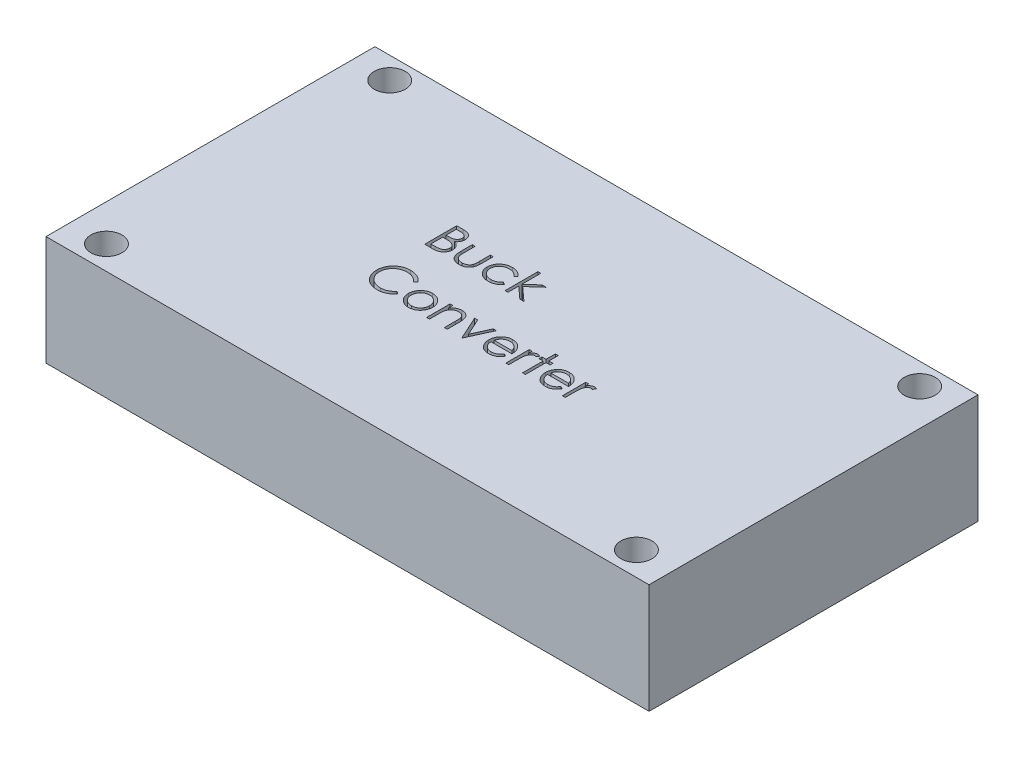
from build123d import *

# Parameters (mm, degrees)
SKETCH1_W           = 66
SKETCH1_H           = 36
BOSS_EXTRUDE1_DEPTH = 12
SKETCH2_R           = 1.7
CUT_EXTRUDE1_DEPTH  = 40.458839314


with BuildPart() as part:
    # Sketch1 → Boss-Extrude1 (new body)
    with BuildSketch(Plane(origin=(0, 0, 0), x_dir=(1, 0, 0), z_dir=(0, 1, 0))):
        Rectangle(SKETCH1_W, SKETCH1_H)
    extrude(amount=BOSS_EXTRUDE1_DEPTH)

    # Sketch2 → Cut-Extrude1 (cut, through all)
    # profile 1 of 17: a face of its own
    with BuildSketch(Plane(origin=(0, 12, 0), x_dir=(1, 0, 0), z_dir=(0, 1, 0))):
        with Locations(Location((-29, 15.616090754, 0), (0, 0, 270))):
            Circle(SKETCH2_R)
    # profile 2 of 17: a face of its own
    with BuildSketch(Plane(origin=(0, 12, 0), x_dir=(1, 0, 0), z_dir=(0, 1, 0))):
        with Locations(Location((29, 15.616090754, 0), (0, 0, 270))):
            Circle(SKETCH2_R)
    # profile 3 of 17: a face of its own
    with BuildSketch(Plane(origin=(0, 12, 0), x_dir=(1, 0, 0), z_dir=(0, 1, 0))):
        with Locations(Location((29, -15.383909246, 0), (0, 0, 270))):
            Circle(SKETCH2_R)
    # profile 4 of 17: a face of its own
    with BuildSketch(Plane(origin=(0, 12, 0), x_dir=(1, 0, 0), z_dir=(0, 1, 0))):
        with Locations(Location((-29, -15.383909246, 0), (0, 0, 270))):
            Circle(SKETCH2_R)
    # profile 5 of 17: a face of its own
    with BuildSketch(Plane(origin=(0, 12, 0), x_dir=(1, 0, 0), z_dir=(0, 1, 0))):
        with BuildLine():
            Line((-11.551282051, 5.5), (-10.868389423, 5.5))
            add(Edge.make_bspline(
                [(-10.868389423, 5.5), (-10.834960945, 5.49982425), (-10.770168235, 5.499483602), (-10.675948793, 5.49420047), (-10.587699982, 5.486996801), (-10.50539621, 5.475566708), (-10.429075507, 5.461774931), (-10.35850787, 5.445073115), (-10.293917698, 5.425046501), (-10.216804961, 5.39320022), (-10.128884301, 5.345877051), (-10.033685908, 5.275948486), (-9.952281668, 5.190416023), (-9.882095351, 5.093933368), (-9.826294232, 4.987797596), (-9.785924934, 4.874538407), (-9.760367059, 4.755616665), (-9.757738625, 4.673973487), (-9.756410256, 4.63271234)],
                knots=[0, 0, 0, 0, 1.001505555, 1.941167018, 2.826882275, 3.653841531, 4.429895133, 5.150066043, 5.825578002, 6.45369114, 7.647487171, 8.808567382, 9.977351308, 11.170798116, 12.373658725, 13.556498008, 14.765093433, 16, 16, 16, 16], degree=3))
            add(Edge.make_bspline(
                [(-9.756410256, 4.63271234), (-9.757503475, 4.594059784), (-9.759651752, 4.518103867), (-9.780194512, 4.407009758), (-9.81235518, 4.301258539), (-9.857060429, 4.201236154), (-9.915162425, 4.10920254), (-9.984020744, 4.024415274), (-10.067097546, 3.950464217), (-10.129340786, 3.909121315), (-10.160957532, 3.888120994)],
                knots=[0, 0, 0, 0, 1.044552857, 2.05264487, 3.044412934, 4.028983338, 5.005914585, 5.980388656, 6.974128949, 8, 8, 8, 8], degree=3))
            add(Edge.make_bspline(
                [(-10.160957532, 3.888120994), (-10.121197104, 3.872855995), (-10.045125557, 3.84365027), (-9.940439545, 3.792014806), (-9.8502447, 3.735852696), (-9.773847554, 3.674520846), (-9.708509899, 3.608412035), (-9.651456957, 3.536556921), (-9.602775583, 3.458018163), (-9.561062659, 3.373614627), (-9.528513903, 3.284208159), (-9.504137999, 3.190637383), (-9.49017055, 3.093237828), (-9.488182909, 3.026952448), (-9.487179487, 2.993489583)],
                knots=[0, 0, 0, 0, 1.27268992, 2.434971085, 3.483601985, 4.442670788, 5.356604649, 6.2567628, 7.179492994, 8.113709626, 9.066344395, 10.018646069, 10.999752585, 12, 12, 12, 12], degree=3))
            add(Edge.make_bspline(
                [(-9.487179487, 2.993489583), (-9.488156333, 2.959322711), (-9.490078305, 2.892098433), (-9.504258277, 2.793343299), (-9.528267384, 2.698968352), (-9.56133853, 2.608363169), (-9.604500845, 2.521703035), (-9.657028809, 2.438889771), (-9.719660373, 2.36075544), (-9.789723242, 2.286431817), (-9.868985387, 2.21960403), (-9.954501142, 2.160088323), (-10.047347462, 2.111142261), (-10.145999456, 2.070026239), (-10.251563772, 2.038619041), (-10.36356638, 2.016646467), (-10.481910681, 2.00184143), (-10.563120433, 2.000624225), (-10.604767628, 2)],
                knots=[0, 0, 0, 0, 0.978564426, 1.925352924, 2.850884081, 3.763762016, 4.682927383, 5.618979971, 6.567305752, 7.547517671, 8.540179244, 9.531824382, 10.526200242, 11.540722885, 12.589160233, 13.674978461, 14.80764778, 16, 16, 16, 16], degree=3))
            Line((-10.604767628, 2), (-11.551282051, 2))
            Line((-11.551282051, 2), (-11.551282051, 5.5))
        make_face()
        with BuildLine():
            Line((-11.237179487, 5.141025641), (-11.237179487, 4.019230769))
            Line((-11.237179487, 4.019230769), (-11.026141827, 4.019230769))
            add(Edge.make_bspline(
                [(-11.026141827, 4.019230769), (-10.995293032, 4.019630692), (-10.935686872, 4.020403425), (-10.849366976, 4.022616942), (-10.769241958, 4.028814985), (-10.695450124, 4.035011248), (-10.628107681, 4.045085835), (-10.567363819, 4.057077958), (-10.512265222, 4.069760863), (-10.448725677, 4.09133035), (-10.376652728, 4.123208025), (-10.299819624, 4.172679861), (-10.232085154, 4.231604215), (-10.174887967, 4.299595176), (-10.128076496, 4.374461362), (-10.095562781, 4.455008243), (-10.073515497, 4.539228375), (-10.071523965, 4.597046627), (-10.070512821, 4.626402244)],
                knots=[0, 0, 0, 0, 1.156816544, 2.235205308, 3.236616184, 4.169592532, 5.011045266, 5.787822928, 6.49130361, 7.128639758, 8.301311294, 9.436451833, 10.541879658, 11.654887649, 12.756523258, 13.837046038, 14.901820046, 16, 16, 16, 16], degree=3))
            add(Edge.make_bspline(
                [(-10.070512821, 4.626402244), (-10.071039001, 4.645828015), (-10.072071161, 4.683933787), (-10.080524463, 4.739483141), (-10.094892038, 4.791726894), (-10.113346331, 4.841381004), (-10.13913502, 4.886892854), (-10.169498483, 4.92983605), (-10.206184173, 4.968748169), (-10.247941486, 5.005117667), (-10.295950109, 5.037362195), (-10.350181401, 5.065602958), (-10.411369078, 5.088343735), (-10.478481933, 5.108259887), (-10.55255302, 5.122248181), (-10.632727573, 5.133901569), (-10.719662292, 5.139834311), (-10.779807395, 5.140619673), (-10.810897436, 5.141025641)],
                knots=[0, 0, 0, 0, 0.91205012, 1.789085906, 2.630437955, 3.453916878, 4.269457761, 5.079663411, 5.91843418, 6.774407191, 7.675494373, 8.627863946, 9.638891023, 10.736472738, 11.911756761, 13.175263542, 14.539845004, 16, 16, 16, 16], degree=3))
            Line((-10.810897436, 5.141025641), (-11.237179487, 5.141025641))
        make_face(mode=Mode.SUBTRACT)
        with BuildLine():
            Line((-11.237179487, 3.66025641), (-11.237179487, 2.358974359))
            Line((-11.237179487, 2.358974359), (-10.789863782, 2.358974359))
            add(Edge.make_bspline(
                [(-10.789863782, 2.358974359), (-10.757844856, 2.359358106), (-10.696132598, 2.360097729), (-10.607031367, 2.362512283), (-10.524448264, 2.368004559), (-10.448760128, 2.376650409), (-10.379149675, 2.386028858), (-10.316451972, 2.398640139), (-10.260158779, 2.413089099), (-10.194884471, 2.435423272), (-10.121380963, 2.470119743), (-10.042170106, 2.522433969), (-9.971743888, 2.584757277), (-9.911938629, 2.656888191), (-9.86292564, 2.735319518), (-9.827270185, 2.818464868), (-9.805279329, 2.904950395), (-9.802617159, 2.963917108), (-9.801282051, 2.993489583)],
                knots=[0, 0, 0, 0, 1.160039823, 2.235823828, 3.228722157, 4.157150951, 4.99529583, 5.772374946, 6.472645482, 7.099169577, 8.269452708, 9.405989375, 10.527446681, 11.663510218, 12.788923519, 13.866172445, 14.929861265, 16, 16, 16, 16], degree=3))
            add(Edge.make_bspline(
                [(-9.801282051, 2.993489583), (-9.801558156, 3.011982924), (-9.802105911, 3.048671306), (-9.810366526, 3.102587125), (-9.822380395, 3.154812998), (-9.837911829, 3.205490739), (-9.860531296, 3.253704115), (-9.886937841, 3.300406674), (-9.917899243, 3.345660154), (-9.966143409, 3.402872407), (-10.036315393, 3.46878942), (-10.136022169, 3.533326923), (-10.249394467, 3.58537473), (-10.33162196, 3.607474206), (-10.374098558, 3.618890224)],
                knots=[0, 0, 0, 0, 0.723448775, 1.435228256, 2.130040452, 2.821711965, 3.505591119, 4.210454504, 4.921174351, 5.648778258, 7.137944449, 8.670945889, 10.280296675, 12, 12, 12, 12], degree=3))
            add(Edge.make_bspline(
                [(-10.374098558, 3.618890224), (-10.391127654, 3.622345308), (-10.428050246, 3.629836643), (-10.488257826, 3.637744346), (-10.556993695, 3.644789406), (-10.634416572, 3.650000564), (-10.720624414, 3.655387107), (-10.815801332, 3.657481929), (-10.919558647, 3.659981189), (-10.991551019, 3.660162323), (-11.028946314, 3.66025641)],
                knots=[0, 0, 0, 0, 0.634451884, 1.375622551, 2.216452059, 3.157844607, 4.20941857, 5.370758133, 6.634282058, 8, 8, 8, 8], degree=3))
            Line((-11.028946314, 3.66025641), (-11.237179487, 3.66025641))
        make_face(mode=Mode.SUBTRACT)
    # profile 6 of 17: a face of its own
    with BuildSketch(Plane(origin=(0, 12, 0), x_dir=(1, 0, 0), z_dir=(0, 1, 0))):
        with BuildLine():
            Line((-8.903846154, 4.557692308), (-8.58974359, 4.557692308))
            Line((-8.58974359, 4.557692308), (-8.58974359, 3.371394231))
            add(Edge.make_bspline(
                [(-8.58974359, 3.371394231), (-8.589601685, 3.336571482), (-8.589330227, 3.269957194), (-8.587489286, 3.174102007), (-8.583159193, 3.086685294), (-8.577745368, 3.007656557), (-8.570783232, 2.937029166), (-8.562499872, 2.875049809), (-8.55324145, 2.821015625), (-8.544178736, 2.788472269), (-8.539963942, 2.77333734)],
                knots=[0, 0, 0, 0, 1.388932606, 2.656963016, 3.823490214, 4.879454478, 5.816252168, 6.653371382, 7.373723809, 8, 8, 8, 8], degree=3))
            add(Edge.make_bspline(
                [(-8.539963942, 2.77333734), (-8.533202487, 2.754314469), (-8.519820146, 2.716664208), (-8.495546663, 2.662275202), (-8.465518326, 2.61189992), (-8.432658498, 2.563595847), (-8.39475909, 2.51879386), (-8.352299619, 2.477569617), (-8.306701382, 2.438365526), (-8.238946359, 2.391980734), (-8.146287093, 2.342265403), (-8.024634338, 2.299369585), (-7.892730112, 2.273733765), (-7.801565392, 2.27075951), (-7.754707532, 2.269230769)],
                knots=[0, 0, 0, 0, 0.725840625, 1.436591201, 2.137033971, 2.831655856, 3.53531722, 4.242432219, 4.957935707, 5.694543706, 7.190802206, 8.724350549, 10.316345118, 12, 12, 12, 12], degree=3))
            add(Edge.make_bspline(
                [(-7.754707532, 2.269230769), (-7.707854024, 2.270792018), (-7.617201156, 2.273812745), (-7.486746187, 2.298596284), (-7.367494772, 2.340001973), (-7.260643821, 2.397809384), (-7.166677981, 2.468551447), (-7.088373562, 2.551560256), (-7.023766308, 2.644209643), (-6.995556887, 2.713333922), (-6.981370192, 2.748096955)],
                knots=[0, 0, 0, 0, 1.157059328, 2.238695713, 3.266970494, 4.264342957, 5.228770407, 6.160125903, 7.074715775, 8, 8, 8, 8], degree=3))
            add(Edge.make_bspline(
                [(-6.981370192, 2.748096955), (-6.977175962, 2.762063254), (-6.967903544, 2.792939329), (-6.957941192, 2.845319078), (-6.948966731, 2.907783682), (-6.941303555, 2.980741891), (-6.935838392, 3.064003043), (-6.932892365, 3.157541119), (-6.92956409, 3.26106248), (-6.929513574, 3.333530239), (-6.929487179, 3.371394231)],
                knots=[0, 0, 0, 0, 0.557542046, 1.232589297, 2.036731608, 2.971723315, 4.038036528, 5.22795436, 6.551621927, 8, 8, 8, 8], degree=3))
            Line((-6.929487179, 3.371394231), (-6.929487179, 4.557692308))
            Line((-6.929487179, 4.557692308), (-6.615384615, 4.557692308))
            Line((-6.615384615, 4.557692308), (-6.615384615, 3.3125))
            add(Edge.make_bspline(
                [(-6.615384615, 3.3125), (-6.61582631, 3.270192829), (-6.616683259, 3.188111129), (-6.622190602, 3.068827017), (-6.631640215, 2.957664772), (-6.6459829, 2.854565552), (-6.662848574, 2.759608071), (-6.684604847, 2.672670625), (-6.710583085, 2.594021071), (-6.7398886, 2.522279294), (-6.774510468, 2.4572324), (-6.811337488, 2.395496583), (-6.85386226, 2.338603648), (-6.898632494, 2.283721511), (-6.94843415, 2.233579983), (-7.002334009, 2.187028507), (-7.059573429, 2.143355476), (-7.121422627, 2.104264196), (-7.18697869, 2.069047551), (-7.256322547, 2.037831473), (-7.330303545, 2.013128896), (-7.407967182, 1.99181823), (-7.489693961, 1.975103761), (-7.575405094, 1.963317194), (-7.665071711, 1.956091863), (-7.72618117, 1.955454818), (-7.757512019, 1.955128205)],
                knots=[0, 0, 0, 0, 1.493040784, 2.896703357, 4.213163133, 5.428574705, 6.569057535, 7.615249723, 8.588095153, 9.490268104, 10.346124644, 11.18633936, 12.024365274, 12.850166724, 13.684164916, 14.514361689, 15.362232829, 16.222528818, 17.093394965, 17.986930858, 18.902426812, 19.842810585, 20.827885679, 21.843828298, 22.894529745, 24, 24, 24, 24], degree=3))
            add(Edge.make_bspline(
                [(-7.757512019, 1.955128205), (-7.788608533, 1.955467912), (-7.849716078, 1.956135468), (-7.939387323, 1.963277276), (-8.025335929, 1.975085447), (-8.107256327, 1.991940664), (-8.185230725, 2.012979734), (-8.259574965, 2.03798327), (-8.329418528, 2.069063751), (-8.395600532, 2.104041309), (-8.45760292, 2.143606584), (-8.515711498, 2.186974624), (-8.56984835, 2.234080687), (-8.620025419, 2.284728044), (-8.665538395, 2.33954498), (-8.706954437, 2.398090541), (-8.744911142, 2.459784629), (-8.779263932, 2.525847792), (-8.808775688, 2.598419802), (-8.834830934, 2.678716899), (-8.856141572, 2.767619415), (-8.87348404, 2.865051344), (-8.887435481, 2.970546385), (-8.897121623, 3.084714801), (-8.902537454, 3.207278493), (-8.903400515, 3.291928383), (-8.903846154, 3.335637019)],
                knots=[0, 0, 0, 0, 1.083640291, 2.129454052, 3.13281866, 4.105697902, 5.042300162, 5.946461698, 6.836384745, 7.703652036, 8.553297018, 9.397182691, 10.228592656, 11.052265423, 11.879314572, 12.708807002, 13.549817954, 14.402308542, 15.300838682, 16.27712199, 17.341985831, 18.484375296, 19.725102775, 21.0496083, 22.476576903, 24, 24, 24, 24], degree=3))
            Line((-8.903846154, 3.335637019), (-8.903846154, 4.557692308))
        make_face()
    # profile 7 of 17: a face of its own
    with BuildSketch(Plane(origin=(0, 12, 0), x_dir=(1, 0, 0), z_dir=(0, 1, 0))):
        with BuildLine():
            Line((-3.384615385, 4.003104968), (-3.647536058, 3.83974359))
            add(Edge.make_bspline(
                [(-3.647536058, 3.83974359), (-3.676365923, 3.875571984), (-3.733112618, 3.946094094), (-3.831651855, 4.037104027), (-3.936663269, 4.115271069), (-4.049941317, 4.17897482), (-4.171327117, 4.22819627), (-4.300341968, 4.263026476), (-4.436967473, 4.284730719), (-4.530632672, 4.287197555), (-4.578625801, 4.288461538)],
                knots=[0, 0, 0, 0, 1.026593902, 2.0206758, 2.988051866, 3.946915611, 4.916868779, 5.907761954, 6.927957743, 8, 8, 8, 8], degree=3))
            add(Edge.make_bspline(
                [(-4.578625801, 4.288461538), (-4.616984758, 4.287404696), (-4.692531681, 4.285323274), (-4.803437834, 4.272312781), (-4.909080187, 4.248670773), (-5.010120896, 4.217519816), (-5.105841315, 4.175769526), (-5.196492233, 4.12495977), (-5.282877723, 4.06590973), (-5.362494465, 3.997499184), (-5.435323472, 3.923100516), (-5.498422386, 3.843346821), (-5.553359319, 3.76062693), (-5.596465275, 3.672875188), (-5.631740446, 3.582099134), (-5.654947166, 3.486585279), (-5.670411861, 3.387557271), (-5.67218119, 3.320038931), (-5.673076923, 3.285857372)],
                knots=[0, 0, 0, 0, 1.112346261, 2.190735716, 3.231507886, 4.247384806, 5.251966152, 6.253067467, 7.256802811, 8.280671706, 9.291813951, 10.270744147, 11.225547591, 12.165006084, 13.100104208, 14.043489273, 15.009504848, 16, 16, 16, 16], degree=3))
            add(Edge.make_bspline(
                [(-5.673076923, 3.285857372), (-5.671297671, 3.241088161), (-5.66776314, 3.152152965), (-5.640061681, 3.020874863), (-5.594717273, 2.893951173), (-5.532659423, 2.772283036), (-5.454182288, 2.65968888), (-5.362009725, 2.558705426), (-5.256090642, 2.471289398), (-5.137358311, 2.398816873), (-5.008600567, 2.340555505), (-4.871210463, 2.299048172), (-4.726310682, 2.2739958), (-4.627103935, 2.270839857), (-4.576522436, 2.269230769)],
                knots=[0, 0, 0, 0, 0.966302908, 1.919585723, 2.883856336, 3.870342332, 4.860282998, 5.839159637, 6.814385684, 7.815993281, 8.834850808, 9.858348828, 10.908058873, 12, 12, 12, 12], degree=3))
            add(Edge.make_bspline(
                [(-4.576522436, 2.269230769), (-4.530167252, 2.270530266), (-4.439067013, 2.273084123), (-4.305899728, 2.294613087), (-4.179119817, 2.32985672), (-4.058731787, 2.37900437), (-3.944955621, 2.442531886), (-3.838526446, 2.520891057), (-3.737326507, 2.611827657), (-3.677829531, 2.682145629), (-3.647536058, 2.717948718)],
                knots=[0, 0, 0, 0, 1.039848629, 2.043578496, 3.018386758, 3.987534228, 4.954977003, 5.934852016, 6.948509513, 8, 8, 8, 8], degree=3))
            Line((-3.647536058, 2.717948718), (-3.384615385, 2.545472756))
            add(Edge.make_bspline(
                [(-3.384615385, 2.545472756), (-3.400203087, 2.522582029), (-3.431326754, 2.476876553), (-3.483354379, 2.412432436), (-3.539474211, 2.352110754), (-3.599467308, 2.295992364), (-3.662550318, 2.242734345), (-3.730878227, 2.19488277), (-3.802247839, 2.149747947), (-3.877496996, 2.109135075), (-3.955847694, 2.072628754), (-4.037189684, 2.041237583), (-4.121169497, 2.014267477), (-4.207885873, 1.99283013), (-4.297509771, 1.975719292), (-4.389809406, 1.96436559), (-4.484752987, 1.955890309), (-4.548925139, 1.955384442), (-4.581430288, 1.955128205)],
                knots=[0, 0, 0, 0, 0.954134338, 1.905101784, 2.851144739, 3.791306361, 4.734911809, 5.6936923, 6.663572882, 7.643865596, 8.638447847, 9.640600242, 10.646758161, 11.676244097, 12.717260333, 13.78922464, 14.880174919, 16, 16, 16, 16], degree=3))
            add(Edge.make_bspline(
                [(-4.581430288, 1.955128205), (-4.631041172, 1.956019485), (-4.728278864, 1.9577664), (-4.870601372, 1.976974875), (-5.006615039, 2.005932491), (-5.136273397, 2.047496225), (-5.259596631, 2.101001001), (-5.37646975, 2.166357915), (-5.486505768, 2.244109705), (-5.58861655, 2.332872475), (-5.682397997, 2.429113115), (-5.762924187, 2.532963033), (-5.832769458, 2.640604081), (-5.888857001, 2.754413607), (-5.933503927, 2.87287898), (-5.96400876, 2.99694922), (-5.983738497, 3.125601474), (-5.986021877, 3.213334356), (-5.987179487, 3.2578125)],
                knots=[0, 0, 0, 0, 1.1129367, 2.181364009, 3.217532258, 4.231199276, 5.232079859, 6.230262199, 7.231623845, 8.250719726, 9.263571943, 10.242672461, 11.195837495, 12.138959767, 13.085126421, 14.0317438, 15.002148558, 16, 16, 16, 16], degree=3))
            add(Edge.make_bspline(
                [(-5.987179487, 3.2578125), (-5.986738471, 3.287990935), (-5.985861217, 3.348020822), (-5.975799289, 3.437115889), (-5.962800816, 3.525024434), (-5.940775079, 3.610632153), (-5.915334448, 3.695237443), (-5.882858916, 3.777820545), (-5.844763521, 3.858765217), (-5.801511574, 3.937862947), (-5.752822829, 4.013812487), (-5.698941595, 4.085566151), (-5.641897259, 4.153985917), (-5.579021147, 4.216709677), (-5.512981493, 4.276245869), (-5.441909918, 4.331003993), (-5.366214066, 4.381144984), (-5.287030743, 4.427595999), (-5.204406032, 4.468955434), (-5.118839362, 4.504588672), (-5.030846332, 4.535041248), (-4.940286188, 4.559150167), (-4.847760015, 4.579367591), (-4.752538677, 4.592085437), (-4.654986455, 4.60107171), (-4.588930432, 4.602062502), (-4.555488782, 4.602564103)],
                knots=[0, 0, 0, 0, 0.990994727, 1.971252077, 2.943264845, 3.907940874, 4.872158414, 5.844625996, 6.82015047, 7.809835459, 8.804511986, 9.781214284, 10.756496977, 11.728388426, 12.696359165, 13.676225489, 14.672885716, 15.677705647, 16.690706858, 17.706033469, 18.721040654, 19.747369689, 20.783475414, 21.830280724, 22.901553713, 24, 24, 24, 24], degree=3))
            add(Edge.make_bspline(
                [(-4.555488782, 4.602564103), (-4.513608674, 4.601642212), (-4.430057794, 4.599803037), (-4.306117088, 4.584324385), (-4.184001894, 4.560987969), (-4.06585479, 4.526415139), (-3.953108276, 4.484551483), (-3.847572826, 4.437538769), (-3.751732722, 4.382944165), (-3.663805133, 4.323224051), (-3.583625615, 4.255863145), (-3.510371123, 4.180056188), (-3.442539474, 4.096197709), (-3.404082762, 4.034391978), (-3.384615385, 4.003104968)],
                knots=[0, 0, 0, 0, 1.095225653, 2.184976855, 3.262915854, 4.344593502, 5.400796181, 6.407717688, 7.363229445, 8.282371371, 9.184954523, 10.097238608, 11.036792983, 12, 12, 12, 12], degree=3))
        make_face()
    # profile 8 of 17: a face of its own
    with BuildSketch(Plane(origin=(0, 12, 0), x_dir=(1, 0, 0), z_dir=(0, 1, 0))):
        Polygon((-2.756410256, 5.58974359), (-2.442307692, 5.58974359), (-2.442307692, 3.514423077), (-1.278445513, 4.557692308), (-0.826923077, 4.557692308), (-2.177283654, 3.346153846), (-0.692307692, 2), (-1.143129006, 2), (-2.442307692, 3.178585737), (-2.442307692, 2), (-2.756410256, 2), align=None)
    # profile 9 of 17: a face of its own
    with BuildSketch(Plane(origin=(0, 12, 0), x_dir=(1, 0, 0), z_dir=(0, 1, 0))):
        with BuildLine():
            Line((-8.320512821, -1.975560897), (-8.595352564, -2.185897436))
            add(Edge.make_bspline(
                [(-8.595352564, -2.185897436), (-8.614958452, -2.162531466), (-8.653905899, -2.11611455), (-8.716565102, -2.050935006), (-8.781866745, -1.989869744), (-8.849785866, -1.932627865), (-8.921544985, -1.881211099), (-8.995405784, -1.832939996), (-9.072603829, -1.789672258), (-9.179355564, -1.737209272), (-9.319003412, -1.682463117), (-9.494798251, -1.636559886), (-9.67830935, -1.60733871), (-9.803506949, -1.604173869), (-9.8671875, -1.602564103)],
                knots=[0, 0, 0, 0, 0.757959112, 1.505699292, 2.245454638, 2.979532153, 3.711538275, 4.438200793, 5.171680507, 5.909471876, 7.393775596, 8.890124382, 10.418191784, 12, 12, 12, 12], degree=3))
            add(Edge.make_bspline(
                [(-9.8671875, -1.602564103), (-9.902270799, -1.602968065), (-9.972111792, -1.603772241), (-10.075760265, -1.614381366), (-10.177473317, -1.629292576), (-10.277184783, -1.651417899), (-10.374767741, -1.679390518), (-10.470860143, -1.712815932), (-10.564070743, -1.754170772), (-10.655688981, -1.799879032), (-10.743468192, -1.851506477), (-10.82652324, -1.907819829), (-10.904551208, -1.968188925), (-10.97761382, -2.032840032), (-11.045785769, -2.101481992), (-11.108573079, -2.174846334), (-11.16575849, -2.252698507), (-11.218475515, -2.334011915), (-11.265688248, -2.418549706), (-11.305218127, -2.506624777), (-11.34022325, -2.59672888), (-11.367922492, -2.689880041), (-11.389847009, -2.785422807), (-11.404974672, -2.883613595), (-11.415463144, -2.984247274), (-11.41626332, -3.052456587), (-11.416666667, -3.086838942)],
                knots=[0, 0, 0, 0, 1.054917814, 2.100044995, 3.131103042, 4.146048494, 5.169673617, 6.183595914, 7.203665975, 8.234915748, 9.262203917, 10.264457458, 11.251630812, 12.227803204, 13.197192746, 14.159520551, 15.12972552, 16.100847026, 17.073214652, 18.039054194, 19.002613845, 19.979014051, 20.95965708, 21.949030935, 22.966165397, 24, 24, 24, 24], degree=3))
            add(Edge.make_bspline(
                [(-11.416666667, -3.086838942), (-11.415404848, -3.138570262), (-11.412927433, -3.240137847), (-11.390879099, -3.388908458), (-11.357374008, -3.531429131), (-11.307158431, -3.666808974), (-11.24523938, -3.796717332), (-11.166998769, -3.918956185), (-11.076382232, -4.03537275), (-10.972107812, -4.143215697), (-10.857701996, -4.241729423), (-10.734954085, -4.328480004), (-10.604169797, -4.400794887), (-10.466793167, -4.460970833), (-10.321767053, -4.507227561), (-10.16935225, -4.539791684), (-10.009880255, -4.561033865), (-9.900910855, -4.563067553), (-9.845452724, -4.564102564)],
                knots=[0, 0, 0, 0, 1.029171465, 2.020641659, 2.987623507, 3.938342917, 4.889210282, 5.84687017, 6.821220943, 7.821438502, 8.827599549, 9.822697543, 10.807740252, 11.797342354, 12.80366471, 13.83203677, 14.896651826, 16, 16, 16, 16], degree=3))
            add(Edge.make_bspline(
                [(-9.845452724, -4.564102564), (-9.784350035, -4.562413784), (-9.664085326, -4.559089862), (-9.4877173, -4.530930613), (-9.318881534, -4.485272695), (-9.157568948, -4.421374773), (-9.004234302, -4.338309485), (-8.858637641, -4.237611607), (-8.720656071, -4.118323274), (-8.637684789, -4.027240146), (-8.595352564, -3.980769231)],
                knots=[0, 0, 0, 0, 1.028121516, 2.023589091, 2.998037872, 3.967518031, 4.937445131, 5.927275754, 6.942489185, 8, 8, 8, 8], degree=3))
            Line((-8.595352564, -3.980769231), (-8.320512821, -4.189002404))
            add(Edge.make_bspline(
                [(-8.320512821, -4.189002404), (-8.34263093, -4.217540856), (-8.386761206, -4.274481062), (-8.458219223, -4.354752772), (-8.53349652, -4.430256807), (-8.61315223, -4.500384428), (-8.696270022, -4.566538894), (-8.784342334, -4.626840725), (-8.876211366, -4.68213161), (-8.971565845, -4.732758534), (-9.070304458, -4.777675781), (-9.172308893, -4.816129549), (-9.277139469, -4.849254439), (-9.384800977, -4.876506375), (-9.495516734, -4.897777459), (-9.608887208, -4.911997134), (-9.725157083, -4.921739048), (-9.803598504, -4.922626964), (-9.843349359, -4.923076923)],
                knots=[0, 0, 0, 0, 0.986787822, 1.968848986, 2.935600012, 3.899624008, 4.868462664, 5.837806735, 6.815139263, 7.798259679, 8.787526145, 9.778297419, 10.776456485, 11.791383307, 12.812564526, 13.85620153, 14.913611965, 16, 16, 16, 16], degree=3))
            add(Edge.make_bspline(
                [(-9.843349359, -4.923076923), (-9.880993026, -4.922814931), (-9.955428716, -4.922296873), (-10.065327468, -4.913904705), (-10.172317049, -4.902454968), (-10.276091674, -4.885214837), (-10.377217649, -4.864870497), (-10.474778234, -4.837599241), (-10.569733444, -4.807050074), (-10.661701785, -4.771145087), (-10.750761485, -4.730628905), (-10.836625296, -4.684837346), (-10.919253729, -4.634155481), (-10.999459149, -4.579700471), (-11.076056733, -4.519723169), (-11.149710258, -4.455056534), (-11.220832735, -4.385918524), (-11.26483542, -4.33606367), (-11.286959135, -4.310997596)],
                knots=[0, 0, 0, 0, 1.114604814, 2.203992996, 3.262667896, 4.300477797, 5.318619304, 6.316056647, 7.298880507, 8.271930387, 9.238335007, 10.195173496, 11.151986948, 12.108099108, 13.064862484, 14.031167946, 15.010108607, 16, 16, 16, 16], degree=3))
            add(Edge.make_bspline(
                [(-11.286959135, -4.310997596), (-11.322394778, -4.267456407), (-11.392838255, -4.180899697), (-11.482963938, -4.040613716), (-11.560111494, -3.894145507), (-11.622487414, -3.740725578), (-11.671250148, -3.580698191), (-11.705031343, -3.413982676), (-11.726982947, -3.240734734), (-11.729493236, -3.122897945), (-11.730769231, -3.063000801)],
                knots=[0, 0, 0, 0, 0.994628077, 1.977248131, 2.950237994, 3.925870899, 4.908910175, 5.911660606, 6.938484602, 8, 8, 8, 8], degree=3))
            add(Edge.make_bspline(
                [(-11.730769231, -3.063000801), (-11.729214037, -3.000045348), (-11.726154291, -2.876184423), (-11.700158496, -2.69441047), (-11.658339699, -2.520259071), (-11.598942811, -2.354055326), (-11.523637459, -2.194925046), (-11.430610846, -2.044083841), (-11.320943703, -1.900567042), (-11.195496136, -1.76655229), (-11.0579288, -1.644012938), (-10.910609986, -1.536206734), (-10.75382804, -1.446489218), (-10.589310188, -1.371493056), (-10.415824506, -1.313848592), (-10.233741137, -1.273495406), (-10.043402222, -1.24837829), (-9.913539797, -1.245203082), (-9.84755609, -1.243589744)],
                knots=[0, 0, 0, 0, 1.032925535, 2.032216505, 3.007276963, 3.968222605, 4.92396291, 5.891752235, 6.871517503, 7.883894988, 8.900124299, 9.891468569, 10.874487609, 11.85992873, 12.854644235, 13.869047385, 14.917252991, 16, 16, 16, 16], degree=3))
            add(Edge.make_bspline(
                [(-9.84755609, -1.243589744), (-9.807341618, -1.244071882), (-9.727741121, -1.245026226), (-9.609988468, -1.254332368), (-9.495346141, -1.269845974), (-9.383735159, -1.290962044), (-9.274612543, -1.317169365), (-9.168812302, -1.351309664), (-9.065713615, -1.390346195), (-8.965966707, -1.435304661), (-8.870050157, -1.485771402), (-8.777993838, -1.541187026), (-8.69052898, -1.601482831), (-8.607040131, -1.666146007), (-8.52892392, -1.736544566), (-8.453962442, -1.810742162), (-8.384701363, -1.890875986), (-8.341948168, -1.94728092), (-8.320512821, -1.975560897)],
                knots=[0, 0, 0, 0, 1.096760587, 2.17092713, 3.219439832, 4.250915756, 5.268269357, 6.278326846, 7.281116186, 8.274029601, 9.260640565, 10.235837813, 11.203064059, 12.156899882, 13.114053108, 14.069676657, 15.032185724, 16, 16, 16, 16], degree=3))
        make_face()
    # profile 10 of 17: a face of its own
    with BuildSketch(Plane(origin=(0, 12, 0), x_dir=(1, 0, 0), z_dir=(0, 1, 0))):
        with BuildLine():
            add(Edge.make_bspline(
                [(-6.45693109, -2.230769231), (-6.408939817, -2.231791122), (-6.314840659, -2.233794801), (-6.177032773, -2.255209766), (-6.045487638, -2.287957131), (-5.919701445, -2.333228693), (-5.80128515, -2.393910643), (-5.688513906, -2.466319934), (-5.581696897, -2.552102528), (-5.517673868, -2.618460596), (-5.485176282, -2.652143429)],
                knots=[0, 0, 0, 0, 1.054011418, 2.066658804, 3.057071809, 4.030435133, 4.997543892, 5.974964718, 6.972108034, 8, 8, 8, 8], degree=3))
            add(Edge.make_bspline(
                [(-5.485176282, -2.652143429), (-5.457194328, -2.684357415), (-5.401771948, -2.748161957), (-5.330706229, -2.85161757), (-5.269484669, -2.958757671), (-5.220421708, -3.071004998), (-5.181736684, -3.187379669), (-5.154270988, -3.30828168), (-5.137934053, -3.433444027), (-5.135731086, -3.518447865), (-5.134615385, -3.561498397)],
                knots=[0, 0, 0, 0, 1.025258237, 2.030674902, 3.01204498, 3.988269485, 4.97094183, 5.956517959, 6.965070386, 8, 8, 8, 8], degree=3))
            add(Edge.make_bspline(
                [(-5.134615385, -3.561498397), (-5.135596722, -3.604798455), (-5.13753589, -3.690361388), (-5.155879507, -3.816380754), (-5.184410593, -3.938575577), (-5.225242431, -4.056434271), (-5.27760054, -4.170317098), (-5.341491227, -4.279726647), (-5.417362845, -4.384878781), (-5.503366841, -4.484880619), (-5.598418718, -4.577046834), (-5.701534866, -4.657375103), (-5.8106889, -4.726196628), (-5.927332253, -4.781633043), (-6.05039974, -4.825342744), (-6.180156808, -4.85604276), (-6.316401878, -4.874604444), (-6.4094291, -4.876988017), (-6.45693109, -4.878205128)],
                knots=[0, 0, 0, 0, 0.998656419, 1.973391657, 2.932242238, 3.890759089, 4.846373663, 5.82037756, 6.809684879, 7.83454468, 8.860553229, 9.859544525, 10.845671541, 11.83227036, 12.833544569, 13.85385346, 14.904124723, 16, 16, 16, 16], degree=3))
            add(Edge.make_bspline(
                [(-6.45693109, -4.878205128), (-6.504665809, -4.876983932), (-6.598156669, -4.874592158), (-6.734882651, -4.856114875), (-6.86487227, -4.825356892), (-6.988100868, -4.781489399), (-7.105245715, -4.726194856), (-7.215032212, -4.657583166), (-7.318232128, -4.577023011), (-7.413304112, -4.484887074), (-7.499302718, -4.384877118), (-7.575175726, -4.279727079), (-7.639066052, -4.170316986), (-7.691424256, -4.056434301), (-7.732256069, -3.938575569), (-7.760787161, -3.816380756), (-7.779130776, -3.690361388), (-7.781069945, -3.604798455), (-7.782051282, -3.561498397)],
                knots=[0, 0, 0, 0, 1.099876186, 2.154163076, 3.173186993, 4.173200201, 5.163417411, 6.152872554, 7.150605724, 8.17532212, 9.198891216, 10.186952605, 11.159729845, 12.11414092, 13.071450619, 14.029093627, 15.002601286, 16, 16, 16, 16], degree=3))
            add(Edge.make_bspline(
                [(-7.782051282, -3.561498397), (-7.780927972, -3.518681852), (-7.77870401, -3.433912449), (-7.762383501, -3.308985388), (-7.735024945, -3.188287999), (-7.696293548, -3.072362523), (-7.646778357, -2.960607087), (-7.586417069, -2.853202256), (-7.514626437, -2.750214456), (-7.459424485, -2.686492376), (-7.431490385, -2.654246795)],
                knots=[0, 0, 0, 0, 1.031353054, 2.041901799, 3.029428768, 4.008703097, 4.981709435, 5.96992636, 6.972712378, 8, 8, 8, 8], degree=3))
            add(Edge.make_bspline(
                [(-7.431490385, -2.654246795), (-7.399041794, -2.620271856), (-7.33522593, -2.553454159), (-7.227877202, -2.467921635), (-7.115383381, -2.394005561), (-6.995658455, -2.334529346), (-6.869975597, -2.287690828), (-6.737756354, -2.255125313), (-6.599480839, -2.233871958), (-6.504921218, -2.23181378), (-6.45693109, -2.230769231)],
                knots=[0, 0, 0, 0, 1.027980169, 2.021703884, 2.998553061, 3.971491411, 4.943284454, 5.930300938, 6.949603206, 8, 8, 8, 8], degree=3))
        make_face()
        with BuildLine():
            add(Edge.make_bspline(
                [(-6.458333333, -2.544871795), (-6.492270945, -2.545836387), (-6.559270073, -2.547740669), (-6.657889658, -2.562224574), (-6.752829812, -2.585172078), (-6.844270656, -2.617776134), (-6.931903829, -2.659875033), (-7.015813231, -2.711583393), (-7.096245671, -2.77221635), (-7.171627734, -2.841679021), (-7.240810046, -2.917558016), (-7.301288023, -2.998406375), (-7.352713129, -3.082912721), (-7.395553288, -3.171164932), (-7.427460476, -3.264057346), (-7.450633499, -3.360537977), (-7.465103739, -3.460803394), (-7.466990118, -3.528964412), (-7.467948718, -3.563601763)],
                knots=[0, 0, 0, 0, 1.021534396, 2.016698045, 2.994645724, 3.958388632, 4.93408049, 5.916473867, 6.921342795, 7.962252576, 8.998418191, 10.008913653, 10.997312074, 11.973003931, 12.956656626, 13.948281152, 14.957379055, 16, 16, 16, 16], degree=3))
            add(Edge.make_bspline(
                [(-7.467948718, -3.563601763), (-7.466341894, -3.60835379), (-7.46315265, -3.697178195), (-7.437217413, -3.827989318), (-7.393831134, -3.95357117), (-7.335243854, -4.073187556), (-7.261837635, -4.183859834), (-7.175350568, -4.282531319), (-7.076710868, -4.36771713), (-6.967094368, -4.438397976), (-6.84874005, -4.494557731), (-6.723483729, -4.534356707), (-6.592843035, -4.5602284), (-6.503562304, -4.562799874), (-6.458333333, -4.564102564)],
                knots=[0, 0, 0, 0, 1.016792936, 2.018143844, 3.017858371, 4.030088057, 5.03801393, 6.028138512, 7.003788237, 7.991172063, 8.984598303, 9.972568034, 10.972917682, 12, 12, 12, 12], degree=3))
            add(Edge.make_bspline(
                [(-6.458333333, -4.564102564), (-6.413106964, -4.562792284), (-6.323831368, -4.560205827), (-6.193372192, -4.534487007), (-6.06845822, -4.494383347), (-5.950226832, -4.438461137), (-5.840660229, -4.367448722), (-5.741311107, -4.283012345), (-5.655562496, -4.183598493), (-5.582228891, -4.073040965), (-5.522682149, -3.953756613), (-5.479498947, -3.82796614), (-5.453501361, -3.697184098), (-5.450320532, -3.608355768), (-5.448717949, -3.563601763)],
                knots=[0, 0, 0, 0, 1.02726834, 2.027799167, 3.010890988, 4.004497153, 4.992059811, 5.971914811, 6.958719428, 7.966827853, 8.981595046, 9.981490638, 10.983022906, 12, 12, 12, 12], degree=3))
            add(Edge.make_bspline(
                [(-5.448717949, -3.563601763), (-5.449676219, -3.528964205), (-5.451561948, -3.460802779), (-5.466036912, -3.360540326), (-5.489192452, -3.264048729), (-5.521164069, -3.171196726), (-5.563818083, -3.082684222), (-5.616234876, -2.998654495), (-5.676465901, -2.917277949), (-5.746483022, -2.841924308), (-5.8217864, -2.772189271), (-5.902251438, -2.711559882), (-5.986036417, -2.660102286), (-6.073415, -2.617416046), (-6.164867567, -2.585468705), (-6.259674697, -2.562092074), (-6.357873506, -2.547801877), (-6.42463255, -2.545854736), (-6.458333333, -2.544871795)],
                knots=[0, 0, 0, 0, 1.042956736, 2.052379634, 3.044323526, 4.02829302, 5.004299113, 5.996692471, 7.007513377, 8.048758398, 9.090003419, 10.095195979, 11.07790575, 12.047570684, 13.018257071, 13.989683339, 14.985167495, 16, 16, 16, 16], degree=3))
        make_face(mode=Mode.SUBTRACT)
    # profile 11 of 17: a face of its own
    with BuildSketch(Plane(origin=(0, 12, 0), x_dir=(1, 0, 0), z_dir=(0, 1, 0))):
        with BuildLine():
            Line((-4.506410256, -2.275641026), (-4.192307692, -2.275641026))
            Line((-4.192307692, -2.275641026), (-4.192307692, -2.736979167))
            add(Edge.make_bspline(
                [(-4.192307692, -2.736979167), (-4.158770057, -2.695136444), (-4.093689106, -2.61393918), (-3.985304773, -2.507218606), (-3.870760873, -2.419273381), (-3.750758869, -2.349169587), (-3.625135859, -2.296322961), (-3.494657589, -2.25815703), (-3.358542883, -2.235272201), (-3.265978446, -2.232281971), (-3.219150641, -2.230769231)],
                knots=[0, 0, 0, 0, 1.12780773, 2.188550248, 3.19190651, 4.159438251, 5.104880172, 6.052711206, 7.014878035, 8, 8, 8, 8], degree=3))
            add(Edge.make_bspline(
                [(-3.219150641, -2.230769231), (-3.171820007, -2.232514426), (-3.079182539, -2.235930195), (-2.944304478, -2.262946886), (-2.818331084, -2.309092141), (-2.701711528, -2.372304211), (-2.596584315, -2.450910685), (-2.504259463, -2.542488466), (-2.427896216, -2.64782455), (-2.376698853, -2.745547706), (-2.342973205, -2.8322365), (-2.321740868, -2.90648325), (-2.303709886, -2.989201401), (-2.288078138, -3.080140991), (-2.277501027, -3.179939181), (-2.269158735, -3.288186873), (-2.263180041, -3.404849003), (-2.262942834, -3.485535631), (-2.262820513, -3.527143429)],
                knots=[0, 0, 0, 0, 1.235846778, 2.418850247, 3.575807741, 4.728682307, 5.871620074, 6.994088408, 8.11269785, 9.256955736, 9.865816715, 10.540099792, 11.271859618, 12.076849838, 12.949306005, 13.892391288, 14.913166135, 16, 16, 16, 16], degree=3))
            Line((-2.262820513, -3.527143429), (-2.262820513, -4.833333333))
            Line((-2.262820513, -4.833333333), (-2.576923077, -4.833333333))
            Line((-2.576923077, -4.833333333), (-2.576923077, -3.630208333))
            add(Edge.make_bspline(
                [(-2.576923077, -3.630208333), (-2.577116285, -3.595385888), (-2.577485859, -3.528776478), (-2.578651506, -3.433407454), (-2.581461312, -3.346920876), (-2.585409625, -3.269523509), (-2.591188656, -3.201289672), (-2.597211287, -3.142080395), (-2.604576264, -3.091970853), (-2.611139177, -3.061805771), (-2.614082532, -3.048277244)],
                knots=[0, 0, 0, 0, 1.430800155, 2.736877192, 3.918605307, 4.986035426, 5.920637409, 6.731861385, 7.431261377, 8, 8, 8, 8], degree=3))
            add(Edge.make_bspline(
                [(-2.614082532, -3.048277244), (-2.624708064, -3.008566059), (-2.645158924, -2.932134314), (-2.695692907, -2.828459961), (-2.759507088, -2.740261774), (-2.837404938, -2.668085052), (-2.928634013, -2.611914215), (-3.032941156, -2.572940261), (-3.149319797, -2.548563991), (-3.231174179, -2.546136859), (-3.273838141, -2.544871795)],
                knots=[0, 0, 0, 0, 1.084156227, 2.086665306, 3.027808233, 3.945421172, 4.874247719, 5.839848303, 6.874090471, 8, 8, 8, 8], degree=3))
            add(Edge.make_bspline(
                [(-3.273838141, -2.544871795), (-3.299105825, -2.5453478), (-3.349109918, -2.5462898), (-3.42325989, -2.555741098), (-3.495184063, -2.571199554), (-3.565604272, -2.592068192), (-3.633112065, -2.620730461), (-3.699876357, -2.653259831), (-3.763383121, -2.693808043), (-3.824986518, -2.738998664), (-3.882299326, -2.789077872), (-3.935627664, -2.841922382), (-3.983165684, -2.898197986), (-4.026234359, -2.956997933), (-4.063412623, -3.019129771), (-4.095865711, -3.083994078), (-4.123401406, -3.151676226), (-4.137084098, -3.198651288), (-4.143930288, -3.222155449)],
                knots=[0, 0, 0, 0, 1.023777757, 2.026029729, 3.023749952, 4.003683103, 4.997618607, 5.993177895, 7.010360494, 8.046726602, 9.087585522, 10.09234134, 11.086953743, 12.070360549, 13.043493632, 14.017870808, 15.008233677, 16, 16, 16, 16], degree=3))
            add(Edge.make_bspline(
                [(-4.143930288, -3.222155449), (-4.147869937, -3.239410652), (-4.156446346, -3.276974326), (-4.165709526, -3.338618746), (-4.174117101, -3.409928721), (-4.18115406, -3.490821038), (-4.185459476, -3.581578913), (-4.190153873, -3.681814751), (-4.191862934, -3.791928239), (-4.192155288, -3.868589932), (-4.192307692, -3.908553686)],
                knots=[0, 0, 0, 0, 0.615963638, 1.340920617, 2.168419149, 3.115676021, 4.16674242, 5.331190069, 6.6087489, 8, 8, 8, 8], degree=3))
            Line((-4.192307692, -3.908553686), (-4.192307692, -4.833333333))
            Line((-4.192307692, -4.833333333), (-4.506410256, -4.833333333))
            Line((-4.506410256, -4.833333333), (-4.506410256, -2.275641026))
        make_face()
    # profile 12 of 17: a face of its own
    with BuildSketch(Plane(origin=(0, 12, 0), x_dir=(1, 0, 0), z_dir=(0, 1, 0))):
        Polygon((-1.814102564, -2.275641026), (-1.474058494, -2.275641026), (-0.625, -4.137820513), (0.224058494, -2.275641026), (0.564102564, -2.275641026), (-0.602564103, -4.833333333), (-0.647435897, -4.833333333), align=None)
    # profile 13 of 17: a face of its own
    with BuildSketch(Plane(origin=(0, 12, 0), x_dir=(1, 0, 0), z_dir=(0, 1, 0))):
        with BuildLine():
            Line((3.201722756, -4.025641026), (3.480769231, -4.172175481))
            add(Edge.make_bspline(
                [(3.480769231, -4.172175481), (3.458532636, -4.211618812), (3.415269027, -4.288359915), (3.340868279, -4.393791775), (3.262876207, -4.488639491), (3.177772239, -4.570369145), (3.08810256, -4.64162053), (2.993369905, -4.703958355), (2.893081087, -4.757076875), (2.787231362, -4.801829403), (2.674931811, -4.836238897), (2.555910295, -4.860543118), (2.429938799, -4.875566387), (2.34359262, -4.877311528), (2.299379006, -4.878205128)],
                knots=[0, 0, 0, 0, 1.120438281, 2.179929193, 3.190490725, 4.156257408, 5.095198341, 6.022838206, 6.959905092, 7.901321166, 8.864066838, 9.862729781, 10.905609505, 12, 12, 12, 12], degree=3))
            add(Edge.make_bspline(
                [(2.299379006, -4.878205128), (2.250237029, -4.877057953), (2.154375267, -4.874820146), (2.01483552, -4.855527682), (1.883456102, -4.824055323), (1.760244398, -4.780089782), (1.645502146, -4.722662457), (1.539001291, -4.652702976), (1.440181765, -4.570570721), (1.352157556, -4.475554277), (1.272913673, -4.37387232), (1.202987853, -4.267916436), (1.144530422, -4.157953211), (1.096977812, -4.044682687), (1.058572947, -3.928818794), (1.031806243, -3.809307326), (1.016376495, -3.686471742), (1.01401205, -3.603374406), (1.012820513, -3.561498397)],
                knots=[0, 0, 0, 0, 1.145258523, 2.234067595, 3.276747158, 4.290159414, 5.277019952, 6.260822364, 7.254936242, 8.264827045, 9.274100331, 10.257902744, 11.220704747, 12.172965371, 13.118907548, 14.062713208, 15.023725156, 16, 16, 16, 16], degree=3))
            add(Edge.make_bspline(
                [(1.012820513, -3.561498397), (1.013879654, -3.522203567), (1.015978732, -3.444326402), (1.02920952, -3.329060858), (1.052657813, -3.217032405), (1.084834137, -3.108147957), (1.126385383, -3.002589823), (1.177217602, -2.90029376), (1.23740998, -2.80136862), (1.283882654, -2.738965486), (1.307291667, -2.707532051)],
                knots=[0, 0, 0, 0, 1.024358464, 2.0301432, 3.019427413, 4.004406732, 4.986367066, 5.972626655, 6.978780325, 8, 8, 8, 8], degree=3))
            add(Edge.make_bspline(
                [(1.307291667, -2.707532051), (1.338999349, -2.669663181), (1.401410296, -2.595125031), (1.506966651, -2.497186705), (1.621266848, -2.41514293), (1.742878474, -2.347135794), (1.873214948, -2.295462147), (2.010524239, -2.256954564), (2.156369825, -2.235376553), (2.256075046, -2.23232872), (2.307091346, -2.230769231)],
                knots=[0, 0, 0, 0, 1.030682036, 2.02871468, 2.997146059, 3.962720338, 4.930598197, 5.918074684, 6.934738563, 8, 8, 8, 8], degree=3))
            add(Edge.make_bspline(
                [(2.307091346, -2.230769231), (2.359538951, -2.23212328), (2.462429197, -2.234779615), (2.612461318, -2.259405948), (2.754422035, -2.298458503), (2.888254539, -2.353612293), (3.0139724, -2.424771845), (3.13075845, -2.512913687), (3.240609962, -2.615331774), (3.304518541, -2.694094983), (3.337039263, -2.734174679)],
                knots=[0, 0, 0, 0, 1.056321875, 2.072262726, 3.055038591, 4.01806755, 4.982017516, 5.957941055, 6.960871419, 8, 8, 8, 8], degree=3))
            add(Edge.make_bspline(
                [(3.337039263, -2.734174679), (3.359166201, -2.764378261), (3.403272794, -2.82458438), (3.458519894, -2.922755537), (3.506477289, -3.025466131), (3.54481025, -3.134376428), (3.575849751, -3.248196008), (3.59830657, -3.367738553), (3.611476189, -3.492968464), (3.614064886, -3.57829502), (3.615384615, -3.621794872)],
                knots=[0, 0, 0, 0, 0.94817472, 1.890038105, 2.849395472, 3.817997239, 4.812318967, 5.836947057, 6.897266129, 8, 8, 8, 8], degree=3))
            Line((3.615384615, -3.621794872), (1.326923077, -3.621794872))
            add(Edge.make_bspline(
                [(1.326923077, -3.621794872), (1.328462683, -3.655495336), (1.331490257, -3.72176594), (1.3456054, -3.818736723), (1.367854174, -3.911110065), (1.399123237, -3.998193107), (1.436990082, -4.081123235), (1.483375799, -4.159285271), (1.538715353, -4.232323202), (1.600441052, -4.300890339), (1.669148148, -4.3619511), (1.741430895, -4.416602877), (1.81832446, -4.462408473), (1.899222543, -4.499588363), (1.983994328, -4.528694679), (2.072666524, -4.5485625), (2.16506464, -4.561869607), (2.228050374, -4.563349272), (2.260116186, -4.564102564)],
                knots=[0, 0, 0, 0, 1.094153842, 2.151609401, 3.174256925, 4.172055639, 5.149267565, 6.128595816, 7.11444997, 8.118368179, 9.117203808, 10.09244225, 11.054858984, 12.015122123, 12.976791628, 13.957293641, 14.960065497, 16, 16, 16, 16], degree=3))
            add(Edge.make_bspline(
                [(2.260116186, -4.564102564), (2.291467334, -4.563494507), (2.353674024, -4.562288006), (2.446314882, -4.550556095), (2.537454409, -4.53158582), (2.626715392, -4.50569583), (2.712286238, -4.474118978), (2.791531788, -4.43601612), (2.864412004, -4.393866373), (2.932528971, -4.345656698), (2.998599964, -4.286648511), (3.06414245, -4.21301279), (3.134419104, -4.125925262), (3.178408697, -4.060379596), (3.201722756, -4.025641026)],
                knots=[0, 0, 0, 0, 0.99110716, 1.966546729, 2.947904876, 3.932708344, 4.903319531, 5.828989031, 6.710028674, 7.56322171, 8.463672341, 9.504779593, 10.677557249, 12, 12, 12, 12], degree=3))
        make_face()
        with BuildLine():
            add(Edge.make_bspline(
                [(3.301282051, -3.307692308), (3.289785427, -3.266029434), (3.267658125, -3.185841813), (3.221421761, -3.074800923), (3.16935022, -2.976113022), (3.107728489, -2.890533389), (3.037909763, -2.814529876), (2.95726458, -2.748111291), (2.866828687, -2.68869384), (2.767069546, -2.63854134), (2.661427761, -2.595851481), (2.550821569, -2.567226366), (2.437963781, -2.547616823), (2.361629495, -2.545790715), (2.323217147, -2.544871795)],
                knots=[0, 0, 0, 0, 1.154881502, 2.222775134, 3.210006277, 4.132804581, 5.035138423, 5.962687519, 6.919655026, 7.923214229, 8.944639381, 9.960483929, 10.97369054, 12, 12, 12, 12], degree=3))
            add(Edge.make_bspline(
                [(2.323217147, -2.544871795), (2.291867709, -2.545483466), (2.22989646, -2.546692612), (2.138595392, -2.558162742), (2.050915693, -2.577122587), (1.966210405, -2.603087543), (1.885589537, -2.637696146), (1.807394769, -2.678279372), (1.733614372, -2.727820956), (1.687473077, -2.765579811), (1.66416266, -2.784655449)],
                knots=[0, 0, 0, 0, 1.04873581, 2.073130211, 3.073294108, 4.04793562, 5.032784715, 6.005352987, 6.992311501, 8, 8, 8, 8], degree=3))
            add(Edge.make_bspline(
                [(1.66416266, -2.784655449), (1.647469378, -2.799749764), (1.613686244, -2.83029698), (1.568545723, -2.882926187), (1.52532525, -2.939677749), (1.485991597, -3.002722874), (1.449914011, -3.071343653), (1.416154033, -3.144961288), (1.385767621, -3.224134418), (1.368671511, -3.279306857), (1.359875801, -3.307692308)],
                knots=[0, 0, 0, 0, 0.879870761, 1.780643979, 2.707998968, 3.669668524, 4.684282772, 5.740141944, 6.837334558, 8, 8, 8, 8], degree=3))
            Line((1.359875801, -3.307692308), (3.301282051, -3.307692308))
        make_face(mode=Mode.SUBTRACT)
    # profile 14 of 17: a face of its own
    with BuildSketch(Plane(origin=(0, 12, 0), x_dir=(1, 0, 0), z_dir=(0, 1, 0))):
        with BuildLine():
            Line((4.153846154, -2.275641026), (4.467948718, -2.275641026))
            Line((4.467948718, -2.275641026), (4.467948718, -2.652143429))
            add(Edge.make_bspline(
                [(4.467948718, -2.652143429), (4.491137477, -2.617087601), (4.535485798, -2.550043602), (4.609198727, -2.461374301), (4.684702058, -2.387959254), (4.762357246, -2.329455735), (4.842735345, -2.285642617), (4.924072297, -2.253549582), (5.007647767, -2.234572266), (5.063809691, -2.232038607), (5.091947115, -2.230769231)],
                knots=[0, 0, 0, 0, 1.2804753, 2.448899062, 3.506932113, 4.484331642, 5.4025378, 6.288909075, 7.142734305, 8, 8, 8, 8], degree=3))
            add(Edge.make_bspline(
                [(5.091947115, -2.230769231), (5.113773442, -2.231959757), (5.158682527, -2.234409343), (5.226665117, -2.251620168), (5.296708569, -2.27909819), (5.341850956, -2.304938413), (5.365384615, -2.318409455)],
                knots=[0, 0, 0, 0, 0.901110191, 1.854092781, 2.881294221, 4, 4, 4, 4], degree=3))
            Line((5.365384615, -2.318409455), (5.192908654, -2.590444712))
            add(Edge.make_bspline(
                [(5.192908654, -2.590444712), (5.177799633, -2.583704445), (5.149119818, -2.57091013), (5.107165252, -2.55576812), (5.068483915, -2.546852204), (5.043840357, -2.545501487), (5.032351763, -2.544871795)],
                knots=[0, 0, 0, 0, 1.180555205, 2.24091978, 3.179933427, 4, 4, 4, 4], degree=3))
            add(Edge.make_bspline(
                [(5.032351763, -2.544871795), (5.007146029, -2.546551832), (4.955733639, -2.549978621), (4.88024914, -2.576917429), (4.807001934, -2.620442669), (4.748830272, -2.668713781), (4.703788019, -2.715261579), (4.671647794, -2.755909981), (4.642165047, -2.801488613), (4.613994826, -2.851218297), (4.588328532, -2.905948143), (4.564373863, -2.965131356), (4.542715, -3.028836485), (4.530364756, -3.073219005), (4.524038462, -3.095953526)],
                knots=[0, 0, 0, 0, 1.125678352, 2.296057538, 3.5422874, 4.923748041, 5.663163013, 6.437101912, 7.23742474, 8.08941207, 8.991984279, 9.93940061, 10.944477711, 12, 12, 12, 12], degree=3))
            add(Edge.make_bspline(
                [(4.524038462, -3.095953526), (4.519306068, -3.116230699), (4.508824176, -3.161143098), (4.498632639, -3.236491623), (4.488563121, -3.325515281), (4.481466502, -3.428461874), (4.47488846, -3.545074318), (4.471178378, -3.675530264), (4.468075237, -3.819963615), (4.467992171, -3.920937968), (4.467948718, -3.973758013)],
                knots=[0, 0, 0, 0, 0.566838948, 1.255505196, 2.06880316, 3.007127437, 4.065329342, 5.249902469, 6.561414163, 8, 8, 8, 8], degree=3))
            Line((4.467948718, -3.973758013), (4.467948718, -4.833333333))
            Line((4.467948718, -4.833333333), (4.153846154, -4.833333333))
            Line((4.153846154, -4.833333333), (4.153846154, -2.275641026))
        make_face()
    # profile 15 of 17: a face of its own
    with BuildSketch(Plane(origin=(0, 12, 0), x_dir=(1, 0, 0), z_dir=(0, 1, 0))):
        Polygon((5.993589744, -1.243589744), (6.307692308, -1.243589744), (6.307692308, -2.275641026), (6.756410256, -2.275641026), (6.756410256, -2.58974359), (6.307692308, -2.58974359), (6.307692308, -4.833333333), (5.993589744, -4.833333333), (5.993589744, -2.58974359), (5.544871795, -2.58974359), (5.544871795, -2.275641026), (5.993589744, -2.275641026), align=None)
    # profile 16 of 17: a face of its own
    with BuildSketch(Plane(origin=(0, 12, 0), x_dir=(1, 0, 0), z_dir=(0, 1, 0))):
        with BuildLine():
            Line((9.394030449, -4.025641026), (9.673076923, -4.172175481))
            add(Edge.make_bspline(
                [(9.673076923, -4.172175481), (9.650840328, -4.211618812), (9.607576719, -4.288359915), (9.533175971, -4.393791775), (9.455183899, -4.488639491), (9.370079931, -4.570369145), (9.280410252, -4.64162053), (9.185677597, -4.703958355), (9.085388779, -4.757076875), (8.979539055, -4.801829403), (8.867239503, -4.836238897), (8.748217987, -4.860543118), (8.622246492, -4.875566387), (8.535900312, -4.877311528), (8.491686699, -4.878205128)],
                knots=[0, 0, 0, 0, 1.120438281, 2.179929193, 3.190490725, 4.156257408, 5.095198341, 6.022838206, 6.959905092, 7.901321166, 8.864066838, 9.862729781, 10.905609505, 12, 12, 12, 12], degree=3))
            add(Edge.make_bspline(
                [(8.491686699, -4.878205128), (8.442544721, -4.877057953), (8.34668296, -4.874820146), (8.207143212, -4.855527682), (8.075763794, -4.824055323), (7.952552091, -4.780089782), (7.837809838, -4.722662457), (7.731308983, -4.652702976), (7.632489457, -4.570570721), (7.544465248, -4.475554277), (7.465221366, -4.37387232), (7.395295546, -4.267916436), (7.336838114, -4.157953211), (7.289285504, -4.044682687), (7.250880639, -3.928818794), (7.224113936, -3.809307326), (7.208684188, -3.686471742), (7.206319742, -3.603374406), (7.205128205, -3.561498397)],
                knots=[0, 0, 0, 0, 1.145258523, 2.234067595, 3.276747158, 4.290159414, 5.277019952, 6.260822364, 7.254936242, 8.264827045, 9.274100331, 10.257902744, 11.220704747, 12.172965371, 13.118907548, 14.062713208, 15.023725156, 16, 16, 16, 16], degree=3))
            add(Edge.make_bspline(
                [(7.205128205, -3.561498397), (7.206187346, -3.522203567), (7.208286425, -3.444326402), (7.221517212, -3.329060858), (7.244965505, -3.217032405), (7.277141829, -3.108147957), (7.318693075, -3.002589823), (7.369525295, -2.90029376), (7.429717672, -2.80136862), (7.476190346, -2.738965486), (7.499599359, -2.707532051)],
                knots=[0, 0, 0, 0, 1.024358464, 2.0301432, 3.019427413, 4.004406732, 4.986367066, 5.972626655, 6.978780325, 8, 8, 8, 8], degree=3))
            add(Edge.make_bspline(
                [(7.499599359, -2.707532051), (7.531307042, -2.669663181), (7.593717988, -2.595125031), (7.699274344, -2.497186705), (7.81357454, -2.41514293), (7.935186166, -2.347135794), (8.06552264, -2.295462147), (8.202831931, -2.256954564), (8.348677517, -2.235376553), (8.448382738, -2.23232872), (8.499399038, -2.230769231)],
                knots=[0, 0, 0, 0, 1.030682036, 2.02871468, 2.997146059, 3.962720338, 4.930598197, 5.918074684, 6.934738563, 8, 8, 8, 8], degree=3))
            add(Edge.make_bspline(
                [(8.499399038, -2.230769231), (8.551846644, -2.23212328), (8.65473689, -2.234779615), (8.804769011, -2.259405948), (8.946729727, -2.298458503), (9.080562232, -2.353612293), (9.206280092, -2.424771845), (9.323066142, -2.512913687), (9.432917654, -2.615331774), (9.496826233, -2.694094983), (9.529346955, -2.734174679)],
                knots=[0, 0, 0, 0, 1.056321875, 2.072262726, 3.055038591, 4.01806755, 4.982017516, 5.957941055, 6.960871419, 8, 8, 8, 8], degree=3))
            add(Edge.make_bspline(
                [(9.529346955, -2.734174679), (9.551473893, -2.764378261), (9.595580487, -2.82458438), (9.650827587, -2.922755537), (9.698784982, -3.025466131), (9.737117943, -3.134376428), (9.768157444, -3.248196008), (9.790614263, -3.367738553), (9.803783881, -3.492968464), (9.806372578, -3.57829502), (9.807692308, -3.621794872)],
                knots=[0, 0, 0, 0, 0.94817472, 1.890038105, 2.849395472, 3.817997239, 4.812318967, 5.836947057, 6.897266129, 8, 8, 8, 8], degree=3))
            Line((9.807692308, -3.621794872), (7.519230769, -3.621794872))
            add(Edge.make_bspline(
                [(7.519230769, -3.621794872), (7.520770376, -3.655495336), (7.52379795, -3.72176594), (7.537913093, -3.818736723), (7.560161867, -3.911110065), (7.591430929, -3.998193107), (7.629297774, -4.081123235), (7.675683491, -4.159285271), (7.731023045, -4.232323202), (7.792748745, -4.300890339), (7.86145584, -4.3619511), (7.933738587, -4.416602877), (8.010632152, -4.462408473), (8.091530236, -4.499588363), (8.176302021, -4.528694679), (8.264974216, -4.5485625), (8.357372332, -4.561869607), (8.420358066, -4.563349272), (8.452423878, -4.564102564)],
                knots=[0, 0, 0, 0, 1.094153842, 2.151609401, 3.174256925, 4.172055639, 5.149267565, 6.128595816, 7.11444997, 8.118368179, 9.117203808, 10.09244225, 11.054858984, 12.015122123, 12.976791628, 13.957293641, 14.960065497, 16, 16, 16, 16], degree=3))
            add(Edge.make_bspline(
                [(8.452423878, -4.564102564), (8.483775026, -4.563494507), (8.545981717, -4.562288006), (8.638622574, -4.550556095), (8.729762101, -4.53158582), (8.819023085, -4.50569583), (8.904593931, -4.474118978), (8.983839481, -4.43601612), (9.056719696, -4.393866373), (9.124836663, -4.345656698), (9.190907656, -4.286648511), (9.256450143, -4.21301279), (9.326726796, -4.125925262), (9.370716389, -4.060379596), (9.394030449, -4.025641026)],
                knots=[0, 0, 0, 0, 0.99110716, 1.966546729, 2.947904876, 3.932708344, 4.903319531, 5.828989031, 6.710028674, 7.56322171, 8.463672341, 9.504779593, 10.677557249, 12, 12, 12, 12], degree=3))
        make_face()
        with BuildLine():
            add(Edge.make_bspline(
                [(9.493589744, -3.307692308), (9.482093119, -3.266029434), (9.459965818, -3.185841813), (9.413729453, -3.074800923), (9.361657912, -2.976113022), (9.300036181, -2.890533389), (9.230217455, -2.814529876), (9.149572273, -2.748111291), (9.059136379, -2.68869384), (8.959377239, -2.63854134), (8.853735454, -2.595851481), (8.743129262, -2.567226366), (8.630271474, -2.547616823), (8.553937187, -2.545790715), (8.51552484, -2.544871795)],
                knots=[0, 0, 0, 0, 1.154881502, 2.222775134, 3.210006277, 4.132804581, 5.035138423, 5.962687519, 6.919655026, 7.923214229, 8.944639381, 9.960483929, 10.97369054, 12, 12, 12, 12], degree=3))
            add(Edge.make_bspline(
                [(8.51552484, -2.544871795), (8.484175401, -2.545483466), (8.422204152, -2.546692612), (8.330903084, -2.558162742), (8.243223385, -2.577122587), (8.158518097, -2.603087543), (8.077897229, -2.637696146), (7.999702461, -2.678279372), (7.925922065, -2.727820956), (7.879780769, -2.765579811), (7.856470353, -2.784655449)],
                knots=[0, 0, 0, 0, 1.04873581, 2.073130211, 3.073294108, 4.04793562, 5.032784715, 6.005352987, 6.992311501, 8, 8, 8, 8], degree=3))
            add(Edge.make_bspline(
                [(7.856470353, -2.784655449), (7.839777071, -2.799749764), (7.805993936, -2.83029698), (7.760853415, -2.882926187), (7.717632942, -2.939677749), (7.678299289, -3.002722874), (7.642221703, -3.071343653), (7.608461726, -3.144961288), (7.578075314, -3.224134418), (7.560979204, -3.279306857), (7.552183494, -3.307692308)],
                knots=[0, 0, 0, 0, 0.879870761, 1.780643979, 2.707998968, 3.669668524, 4.684282772, 5.740141944, 6.837334558, 8, 8, 8, 8], degree=3))
            Line((7.552183494, -3.307692308), (9.493589744, -3.307692308))
        make_face(mode=Mode.SUBTRACT)
    # profile 17 of 17: a face of its own
    with BuildSketch(Plane(origin=(0, 12, 0), x_dir=(1, 0, 0), z_dir=(0, 1, 0))):
        with BuildLine():
            Line((10.346153846, -2.275641026), (10.66025641, -2.275641026))
            Line((10.66025641, -2.275641026), (10.66025641, -2.652143429))
            add(Edge.make_bspline(
                [(10.66025641, -2.652143429), (10.683445169, -2.617087601), (10.72779349, -2.550043602), (10.801506419, -2.461374301), (10.877009751, -2.387959254), (10.954664938, -2.329455735), (11.035043038, -2.285642617), (11.11637999, -2.253549582), (11.199955459, -2.234572266), (11.256117384, -2.232038607), (11.284254808, -2.230769231)],
                knots=[0, 0, 0, 0, 1.2804753, 2.448899062, 3.506932113, 4.484331642, 5.4025378, 6.288909075, 7.142734305, 8, 8, 8, 8], degree=3))
            add(Edge.make_bspline(
                [(11.284254808, -2.230769231), (11.306081134, -2.231959757), (11.350990219, -2.234409343), (11.418972809, -2.251620168), (11.489016261, -2.27909819), (11.534158648, -2.304938413), (11.557692308, -2.318409455)],
                knots=[0, 0, 0, 0, 0.901110191, 1.854092781, 2.881294221, 4, 4, 4, 4], degree=3))
            Line((11.557692308, -2.318409455), (11.385216346, -2.590444712))
            add(Edge.make_bspline(
                [(11.385216346, -2.590444712), (11.370107325, -2.583704445), (11.34142751, -2.57091013), (11.299472944, -2.55576812), (11.260791607, -2.546852204), (11.236148049, -2.545501487), (11.224659455, -2.544871795)],
                knots=[0, 0, 0, 0, 1.180555205, 2.24091978, 3.179933427, 4, 4, 4, 4], degree=3))
            add(Edge.make_bspline(
                [(11.224659455, -2.544871795), (11.199453722, -2.546551832), (11.148041332, -2.549978621), (11.072556832, -2.576917429), (10.999309627, -2.620442669), (10.941137964, -2.668713781), (10.896095712, -2.715261579), (10.863955486, -2.755909981), (10.834472739, -2.801488613), (10.806302519, -2.851218297), (10.780636224, -2.905948143), (10.756681555, -2.965131356), (10.735022692, -3.028836485), (10.722672448, -3.073219005), (10.716346154, -3.095953526)],
                knots=[0, 0, 0, 0, 1.125678352, 2.296057538, 3.5422874, 4.923748041, 5.663163013, 6.437101912, 7.23742474, 8.08941207, 8.991984279, 9.93940061, 10.944477711, 12, 12, 12, 12], degree=3))
            add(Edge.make_bspline(
                [(10.716346154, -3.095953526), (10.71161376, -3.116230699), (10.701131869, -3.161143098), (10.690940331, -3.236491623), (10.680870813, -3.325515281), (10.673774195, -3.428461874), (10.667196152, -3.545074318), (10.66348607, -3.675530264), (10.66038293, -3.819963615), (10.660299863, -3.920937968), (10.66025641, -3.973758013)],
                knots=[0, 0, 0, 0, 0.566838948, 1.255505196, 2.06880316, 3.007127437, 4.065329342, 5.249902469, 6.561414163, 8, 8, 8, 8], degree=3))
            Line((10.66025641, -3.973758013), (10.66025641, -4.833333333))
            Line((10.66025641, -4.833333333), (10.346153846, -4.833333333))
            Line((10.346153846, -4.833333333), (10.346153846, -2.275641026))
        make_face()
    extrude(amount=-CUT_EXTRUDE1_DEPTH, mode=Mode.SUBTRACT)


with BuildPart() as cut_extrude1_piece_1:
    # of the separate pieces the step leaves, piece 1, a body of its own (cut_extrude1_pieces)
    add(part.part.solids().sort_by_distance((-33, 0, 18))[0])


with BuildPart() as cut_extrude1_piece_2:
    # of the separate pieces the step leaves, piece 2, a body of its own (cut_extrude1_pieces)
    add(part.part.solids().sort_by_distance((-7.467948718, 0, 3.563601763))[0])


with BuildPart() as cut_extrude1_piece_3:
    # of the separate pieces the step leaves, piece 3, a body of its own (cut_extrude1_pieces)
    add(part.part.solids().sort_by_distance((-11.028946314, 0, -3.66025641))[0])


with BuildPart() as cut_extrude1_piece_4:
    # of the separate pieces the step leaves, piece 4, a body of its own (cut_extrude1_pieces)
    add(part.part.solids().sort_by_distance((-10.810897436, 0, -5.141025641))[0])


with BuildPart() as cut_extrude1_piece_5:
    # of the separate pieces the step leaves, piece 5, a body of its own (cut_extrude1_pieces)
    add(part.part.solids().sort_by_distance((8.51552484, 0, 2.544871795))[0])


with BuildPart() as cut_extrude1_piece_6:
    # of the separate pieces the step leaves, piece 6, a body of its own (cut_extrude1_pieces)
    add(part.part.solids().sort_by_distance((2.323217147, 0, 2.544871795))[0])


solid = Compound([cut_extrude1_piece_1.part, cut_extrude1_piece_2.part, cut_extrude1_piece_3.part, cut_extrude1_piece_4.part, cut_extrude1_piece_5.part, cut_extrude1_piece_6.part])
